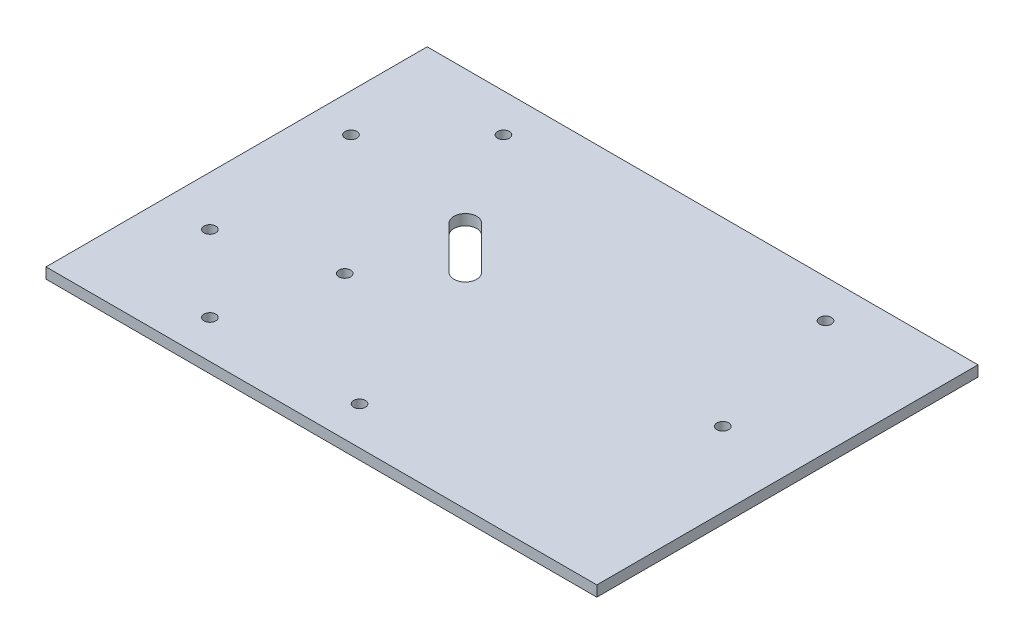
from build123d import *

# Parameters (mm, degrees)
SKETCH1_W           = 144.5
SKETCH1_H           = 100
SKETCH1_R           = 1.55
BOSS_EXTRUDE1_DEPTH = 2.8
CUT_EXTRUDE1_REACH  = 89.908
CUT_EXTRUDE2_REACH  = 89.908
SKETCH3_R           = 1.55
CUT_EXTRUDE3_REACH  = 89.908
SKETCH4_R           = 1.55


with BuildPart() as part:
    # Sketch1 → Boss-Extrude1 (new body)
    with BuildSketch(Plane(origin=(0, 0, 0), x_dir=(1, 0, 0), z_dir=(0, 1, 0))):
        Rectangle(SKETCH1_W, SKETCH1_H)
        with Locations(Location((-59.25, -20, 0), (0, 0, 270))):
            Circle(SKETCH1_R, mode=Mode.SUBTRACT)
        with Locations(Location((-39.25, -40, 0), (0, 0, 270))):
            Circle(SKETCH1_R, mode=Mode.SUBTRACT)
        with Locations(Location((-31.57233047, -12.32233047, 0), (0, 0, 270))):
            Circle(SKETCH1_R, mode=Mode.SUBTRACT)
    extrude(amount=BOSS_EXTRUDE1_DEPTH)

    # Sketch2 → Cut-Extrude1 (cut, up to next)
    with BuildSketch(Plane(origin=(0, 2.8, 0), x_dir=(1, 0, 0), z_dir=(0, 1, 0)), mode=Mode.PRIVATE) as cut_extrude1_sk1:
        with BuildLine():
            Line((-25.128679656, 17.121320344), (-13.814971157, 5.807611845))
            ThreePointArc((-13.814971157, 5.807611845), (-13.814971157, 1.564971157), (-18.057611845, 1.564971157))
            Line((-18.057611845, 1.564971157), (-29.371320344, 12.878679656))
            ThreePointArc((-29.371320344, 12.878679656), (-29.371320344, 17.121320344), (-25.128679656, 17.121320344))
        make_face()
    cut_extrude1_tool1 = extrude(cut_extrude1_sk1.sketch, amount=-CUT_EXTRUDE1_REACH, mode=Mode.PRIVATE) & part.part
    add(cut_extrude1_tool1.solids().sort_by_distance((-21.593146, 2.8, -9.343146))[0], mode=Mode.SUBTRACT)

    # Sketch3 → Cut-Extrude2 (cut, up to next)
    with BuildSketch(Plane(origin=(0, 2.8, 0), x_dir=(1, 0, 0), z_dir=(0, 1, 0)), mode=Mode.PRIVATE) as cut_extrude2_sk1:
        with Locations(Location((-62.25, 20, 0), (0, 0, 270))):
            Circle(SKETCH3_R)
    cut_extrude2_tool1 = extrude(cut_extrude2_sk1.sketch, amount=-CUT_EXTRUDE2_REACH, mode=Mode.PRIVATE) & part.part
    # Sketch3 → Cut-Extrude2 (cut, up to next)
    with BuildSketch(Plane(origin=(0, 2.8, 0), x_dir=(1, 0, 0), z_dir=(0, 1, 0)), mode=Mode.PRIVATE) as cut_extrude2_sk2:
        with Locations(Location((-42.25, 40, 0), (0, 0, 270))):
            Circle(SKETCH3_R)
    cut_extrude2_tool2 = extrude(cut_extrude2_sk2.sketch, amount=-CUT_EXTRUDE2_REACH, mode=Mode.PRIVATE) & part.part
    # Sketch3 → Cut-Extrude2 (cut, up to next)
    with BuildSketch(Plane(origin=(0, 2.8, 0), x_dir=(1, 0, 0), z_dir=(0, 1, 0)), mode=Mode.PRIVATE) as cut_extrude2_sk3:
        with Locations(Location((42.25, 40, 0), (0, 0, 270))):
            Circle(SKETCH3_R)
    cut_extrude2_tool3 = extrude(cut_extrude2_sk3.sketch, amount=-CUT_EXTRUDE2_REACH, mode=Mode.PRIVATE) & part.part
    # Sketch3 → Cut-Extrude2 (cut, up to next)
    with BuildSketch(Plane(origin=(0, 2.8, 0), x_dir=(1, 0, 0), z_dir=(0, 1, 0)), mode=Mode.PRIVATE) as cut_extrude2_sk4:
        with Locations(Location((0, -40, 0), (0, 0, 270))):
            Circle(SKETCH3_R)
    cut_extrude2_tool4 = extrude(cut_extrude2_sk4.sketch, amount=-CUT_EXTRUDE2_REACH, mode=Mode.PRIVATE) & part.part
    add(cut_extrude2_tool1.solids().sort_by_distance((-62.25, 2.8, -20))[0], mode=Mode.SUBTRACT)
    add(cut_extrude2_tool2.solids().sort_by_distance((-42.25, 2.8, -40))[0], mode=Mode.SUBTRACT)
    add(cut_extrude2_tool3.solids().sort_by_distance((42.25, 2.8, -40))[0], mode=Mode.SUBTRACT)
    add(cut_extrude2_tool4.solids().sort_by_distance((0, 2.8, 40))[0], mode=Mode.SUBTRACT)

    # Sketch4 → Cut-Extrude3 (cut, up to next)
    with BuildSketch(Plane(origin=(0, 2.8, 0), x_dir=(1, 0, 0), z_dir=(0, 1, 0)), mode=Mode.PRIVATE) as cut_extrude3_sk1:
        with Locations(Location((52.75, 2.56, 0), (0, 0, 270))):
            Circle(SKETCH4_R)
    cut_extrude3_tool1 = extrude(cut_extrude3_sk1.sketch, amount=-CUT_EXTRUDE3_REACH, mode=Mode.PRIVATE) & part.part
    add(cut_extrude3_tool1.solids().sort_by_distance((52.75, 2.8, -2.56))[0], mode=Mode.SUBTRACT)


solid = part.part
